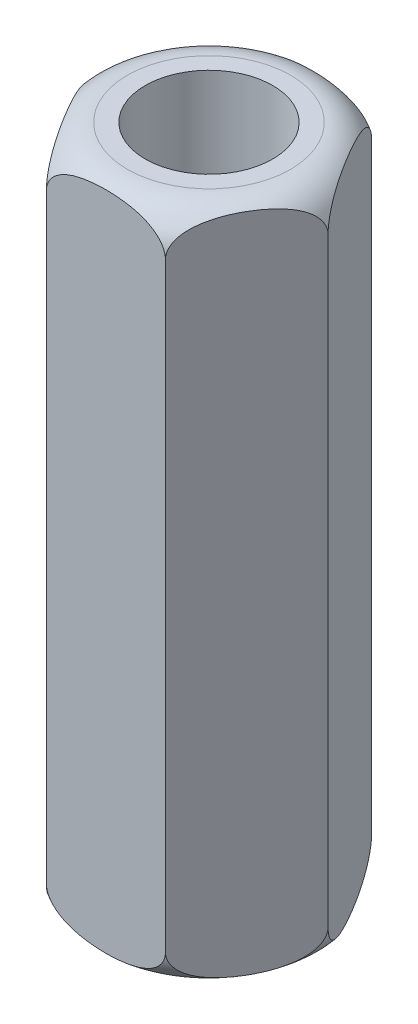
from build123d import *

# Parameters (mm, degrees)
BOSS_EXTRUDE1_DEPTH      = 18
M3_CLEARANCE_HOLE1_D     = 3.4
M3_CLEARANCE_HOLE1_DEPTH = 20
M3_CLEARANCE_HOLE1_TIP   = 1.021463052


with BuildPart() as part:
    # Sketch1 → Boss-Extrude1 (new body)
    with BuildSketch(Plane(origin=(0, 0, 0), x_dir=(1, 0, 0), z_dir=(0, 1, 0))):
        Polygon((3.175426481, 0), (1.58771324, 2.75), (-1.58771324, 2.75), (-3.175426481, 0), (-1.58771324, -2.75), (1.58771324, -2.75), align=None)
    extrude(amount=BOSS_EXTRUDE1_DEPTH)

    # M3 Clearance Hole1
    with Locations(Plane(origin=(0, 18, 0), x_dir=(-1, 0, 0), z_dir=(0, 1, 0))):
        with Locations((0, 0)):
            Hole(M3_CLEARANCE_HOLE1_D / 2, depth=M3_CLEARANCE_HOLE1_DEPTH)
            with Locations((0, 0, -(M3_CLEARANCE_HOLE1_DEPTH + M3_CLEARANCE_HOLE1_TIP / 2))):  # 118° drill point
                Cone(0, M3_CLEARANCE_HOLE1_D / 2, M3_CLEARANCE_HOLE1_TIP, mode=Mode.SUBTRACT)

    # Sketch4 → Cut-Revolve1 (revolve, cut)
    with BuildSketch(Plane.XY, mode=Mode.PRIVATE) as cut_revolve1_sk:
        with BuildLine():
            Line((-2.175426481, 18), (-3.175426481, 18))
            Line((-3.175426481, 18), (-3.175426481, 17))
            ThreePointArc((-3.175426481, 17), (-2.882533262, 17.707106781), (-2.175426481, 18))
        make_face()
        with BuildLine():
            Line((-3.175426481, 1), (-3.175426481, 0))
            Line((-3.175426481, 0), (-2.175426481, 0))
            ThreePointArc((-2.175426481, 0), (-2.882533262, 0.292893219), (-3.175426481, 1))
        make_face()
    revolve(cut_revolve1_sk.sketch.rotate(Axis((0, 18, 0), (0, -1, 0)), 270), axis=Axis((0, 18, 0), (0, -1, 0)), mode=Mode.SUBTRACT)


solid = part.part
